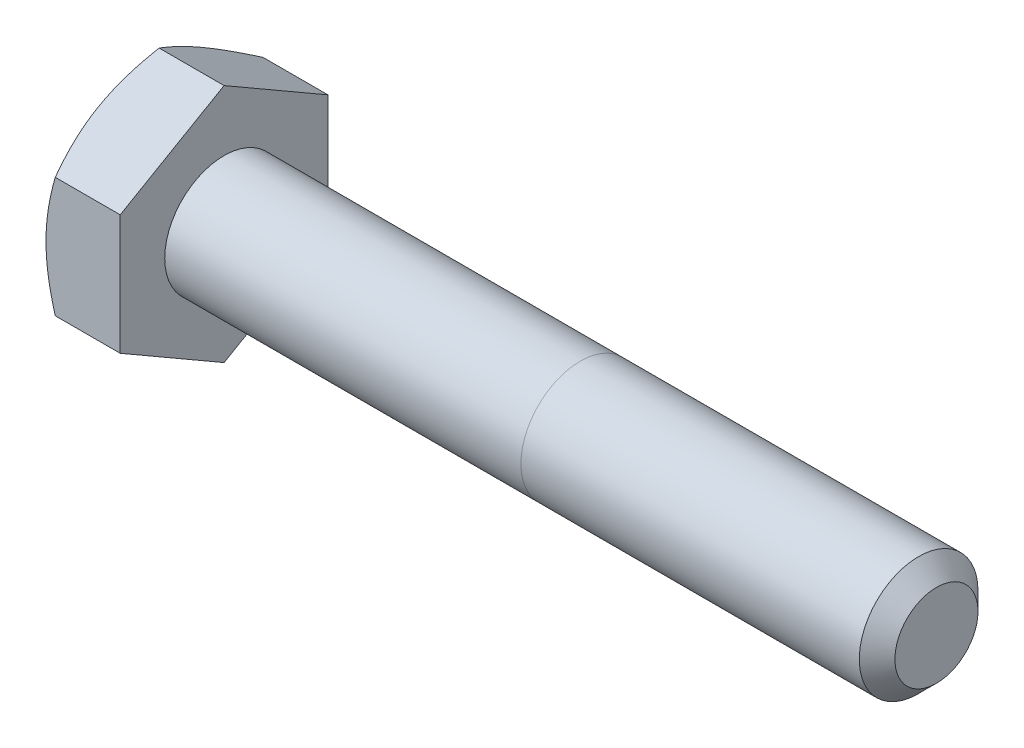
from build123d import *

# Parameters (mm, degrees)
SKETCH5_R           = 3.175
BOSS_EXTRUDE3_DEPTH = 38.1
CHAMFER1_SIZE       = 0.9525
BOSS_EXTRUDE4_DEPTH = 3.96875
SKETCH8_OUTSIDE_W   = 174.316
SKETCH8_OUTSIDE_H   = 176.036
SKETCH8_OUTSIDE_R   = 5.55625
CUT_EXTRUDE3_DEPTH  = 43.916362762
CUT_EXTRUDE3_DRAFT  = -60
CUT_EXTRUDE4_DEPTH  = 0.254
CIRPATTERN1_COUNT   = 3


with BuildPart() as part:
    # Sketch5 → Boss-Extrude3 (new body)
    with BuildSketch(Plane(origin=(21.034375, 0, 0), x_dir=(0, 0, -1), z_dir=(1, 0, 0))):
        Circle(SKETCH5_R)
    extrude(amount=-BOSS_EXTRUDE3_DEPTH)

    # Chamfer1
    chamfer1_edges = [part.edges().sort_by_distance(p)[0] for p in [
        (21.034375, 0, 3.175),
    ]]
    chamfer(chamfer1_edges, length=CHAMFER1_SIZE)

    # Sketch11 → Revolve1 (revolve)
    with BuildSketch(Plane.XY):
        Polygon((-17.065625, 3.175), (-17.065625, 0), (5.159375, 0), (1.984375, 3.175), align=None)
    revolve(axis=Axis((-17.065625, 0, 0), (1, 0, 0)))

    # Sketch6 → Boss-Extrude4 (add)
    with BuildSketch(Plane.ZY.offset(17.065625)):
        Polygon((5.55625, 3.207902433), (0, 6.415804866), (-5.55625, 3.207902433), (-5.55625, -3.207902433), (0, -6.415804866), (5.55625, -3.207902433), align=None)
    extrude(amount=BOSS_EXTRUDE4_DEPTH)


with BuildPart() as cut_extrude3_tool:
    # Sketch8 outside → Cut-Extrude3 (with draft: the straight prism first)
    with BuildSketch(Plane.ZY.offset(21.034375)):
        Rectangle(SKETCH8_OUTSIDE_W, SKETCH8_OUTSIDE_H)
        Circle(SKETCH8_OUTSIDE_R, mode=Mode.SUBTRACT)
    extrude(amount=-CUT_EXTRUDE3_DEPTH)
    # Cut-Extrude3: the draft: its side faces are tilted about the plane it starts from
    cut_extrude3_sides = [cut_extrude3_tool.faces().sort_by_distance(p)[0] for p in [
        (0.923806381, -88.018, 0),
        (0.923806381, 0, 87.158),
        (0.923806381, 88.018, 0),
        (0.923806381, 0, -87.158),
        (0.923806381, 0, -5.55625),
    ]]
    draft(cut_extrude3_sides, Plane.ZY.offset(21.034375), CUT_EXTRUDE3_DRAFT)


with BuildPart() as part_1:
    add(part.part)

    # Cut-Extrude3: cut by cut_extrude3_tool
    add(cut_extrude3_tool.part, mode=Mode.SUBTRACT)

    # Sketch12 → Cut-Extrude4 (cut)
    with BuildSketch(Plane.ZY.offset(21.034375)):
        with BuildLine():
            Line((0.1666875, 4.2783125), (0.1666875, 2.3891875))
            ThreePointArc((0.1666875, 2.3891875), (0, 2.2225), (-0.1666875, 2.3891875))
            Line((-0.1666875, 2.3891875), (-0.1666875, 4.2783125))
            ThreePointArc((-0.1666875, 4.2783125), (0, 4.445), (0.1666875, 4.2783125))
        make_face()
    cut_extrude4 = extrude(amount=-CUT_EXTRUDE4_DEPTH, mode=Mode.SUBTRACT)

    # CirPattern1: Cut-Extrude4 ×3 about axis
    cirpattern1_axis = Axis((0, 0, 0), (1, 0, 0))
    for i in range(1, CIRPATTERN1_COUNT):
        add(cut_extrude4.rotate(cirpattern1_axis, i * 360 / CIRPATTERN1_COUNT), mode=Mode.SUBTRACT)


solid = part_1.part
